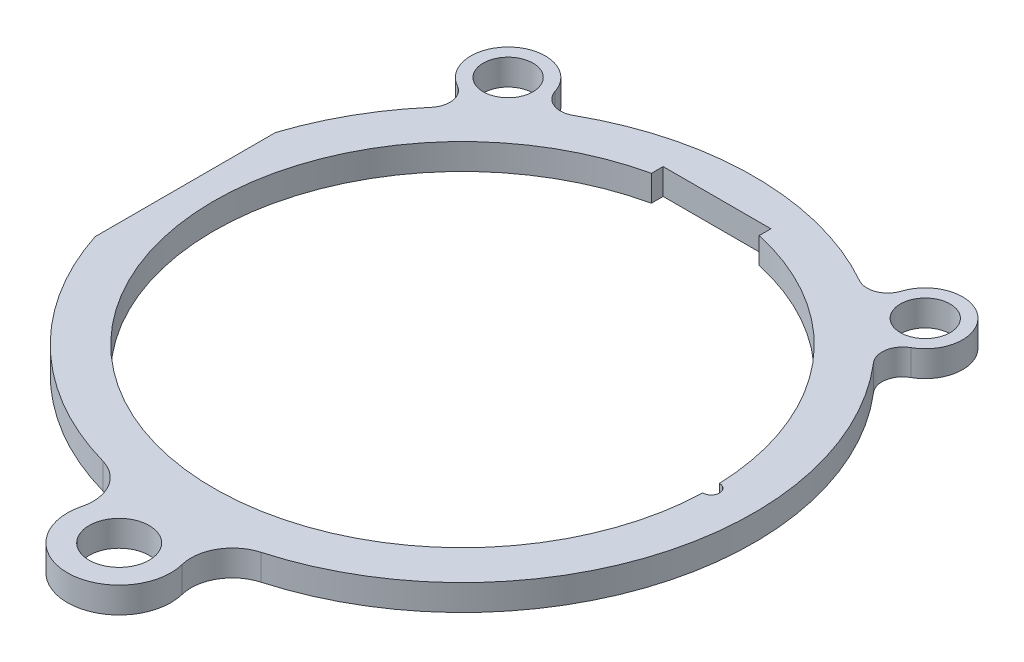
from build123d import *
from build123d.topology import SkipClean

# Parameters (mm, degrees)
SKETCH1_R           = 21.59
BOSS_EXTRUDE1_DEPTH = 0.79375
SKETCH2_R           = 1.4224
CUT_EXTRUDE1_DEPTH  = 31.574112518
CUT_EXTRUDE2_DEPTH  = 31.574112518
SKETCH4_R           = 0.508
CUT_EXTRUDE3_DEPTH  = 31.574112518
SKETCH5_R           = 1.0922
CUT_EXTRUDE4_DEPTH  = 31.574112518
SKETCH6_R           = 1.524
SKETCH6_R_2         = 1.8415
BOSS_EXTRUDE2_DEPTH = 1.5875


with BuildPart() as part:
    # Sketch1 → Boss-Extrude1 (new, symmetric)
    with BuildSketch(Plane(origin=(0, 0, 0), x_dir=(1, 0, 0), z_dir=(0, 1, 0))):
        with Locations(Location((0, 0, 0), (0, 0, 270))):
            Circle(SKETCH1_R)
        with BuildLine():
            Line((-3.302, 14.8779836), (-3.302, 15.5956))
            Line((-3.302, 15.5956), (3.302, 15.5956))
            Line((3.302, 15.5956), (3.302, 14.8779836))
            ThreePointArc((3.302, 14.8779836), (11.8865487, 9.537691545), (15.24, 0))
            ThreePointArc((15.24, 0), (-9.537691545, -11.8865487), (-3.302, 14.8779836))
        make_face(mode=Mode.SUBTRACT)
    extrude(amount=BOSS_EXTRUDE1_DEPTH, both=True)

    # Sketch2 → Cut-Extrude1 (cut, through all)
    with BuildSketch(Plane(origin=(0, 0.79375, 0), x_dir=(1, 0, 0), z_dir=(0, 1, 0))):
        with Locations(Location((0, 18.415, 0), (0, 0, 270))):
            Circle(SKETCH2_R)
        with Locations(Location((0, -18.415, 0), (0, 0, 270))):
            Circle(SKETCH2_R)
    extrude(amount=-CUT_EXTRUDE1_DEPTH, mode=Mode.SUBTRACT)

    # Sketch3 → Cut-Extrude2 (cut, through all)
    with BuildSketch(Plane(origin=(0, 0.79375, 0), x_dir=(1, 0, 0), z_dir=(0, 1, 0))):
        with BuildLine():
            Line((-20.871224203, 5.5245), (-16.984058744, 5.5245))
            Line((-16.984058744, 5.5245), (-16.984058744, -5.5245))
            Line((-16.984058744, -5.5245), (-20.871224203, -5.5245))
            ThreePointArc((-20.871224203, -5.5245), (-21.59, 0), (-20.871224203, 5.5245))
        make_face()
    extrude(amount=-CUT_EXTRUDE2_DEPTH, mode=Mode.SUBTRACT)

    # Sketch4 → Cut-Extrude3 (cut, through all)
    with BuildSketch(Plane(origin=(0, 0.79375, 0), x_dir=(1, 0, 0), z_dir=(0, 1, 0))):
        with Locations((15.24, 0)):
            Circle(SKETCH4_R)
    extrude(amount=-CUT_EXTRUDE3_DEPTH, mode=Mode.SUBTRACT)

    # Sketch5 → Cut-Extrude4 (cut, through all)
    # profile 1 of 16: a face of its own
    with BuildSketch(Plane(origin=(0, 0.79375, 0), x_dir=(1, 0, 0), z_dir=(0, 1, 0))):
        with BuildLine():
            ThreePointArc((-16.984058744, 5.5245), (-16.237733521, 7.437362555), (-15.276788696, 9.25192298))
            Line((-15.276788696, 9.25192298), (-17.314108781, 10.80523309))
            ThreePointArc((-17.314108781, 10.80523309), (-17.76113274, 11.28937197), (-18.016469323, 11.896845513))
            ThreePointArc((-18.016469323, 11.896845513), (-19.70316913, 8.826846902), (-20.871224203, 5.5245))
            Line((-20.871224203, 5.5245), (-16.984058744, 5.5245))
        make_face()
    # profile 2 of 16: a face of its own
    with BuildSketch(Plane(origin=(0, 0.79375, 0), x_dir=(1, 0, 0), z_dir=(0, 1, 0))):
        with BuildLine():
            Line((-17.314108781, 10.80523309), (-15.276788696, 9.25192298))
            ThreePointArc((-15.276788696, 9.25192298), (-14.202798716, 10.828613037), (-12.966760902, 12.28175327))
            Line((-12.966760902, 12.28175327), (-15.004080987, 13.83506338))
            ThreePointArc((-15.004080987, 13.83506338), (-15.589304916, 14.13793931), (-16.242705475, 14.223312513))
            ThreePointArc((-16.242705475, 14.223312513), (-17.169038314, 13.0901575), (-18.016469323, 11.896845513))
            ThreePointArc((-18.016469323, 11.896845513), (-17.76113274, 11.28937197), (-17.314108781, 10.80523309))
        make_face()
        with Locations((-16.159094884, 12.320148235)):
            Circle(SKETCH5_R, mode=Mode.SUBTRACT)
    # profile 3 of 16: a face of its own
    with BuildSketch(Plane(origin=(0, 0.79375, 0), x_dir=(1, 0, 0), z_dir=(0, 1, 0))):
        with Locations((-16.159094884, 12.320148235)):
            Circle(SKETCH5_R)
    # profile 4 of 16: a face of its own
    with BuildSketch(Plane(origin=(0, 0.79375, 0), x_dir=(1, 0, 0), z_dir=(0, 1, 0))):
        with BuildLine():
            Line((-15.004080987, 13.83506338), (-12.966760902, 12.28175327))
            ThreePointArc((-12.966760902, 12.28175327), (-7.645640437, 16.140710455), (-1.288911844, 17.813395463))
            ThreePointArc((-1.288911844, 17.813395463), (-0.308118121, 19.803627014), (1.4224, 18.415))
            ThreePointArc((1.4224, 18.415), (1.388627014, 18.106881879), (1.288911844, 17.813395463))
            ThreePointArc((1.288911844, 17.813395463), (5.420875683, 17.017416329), (9.25192298, 15.276788696))
            Line((9.25192298, 15.276788696), (10.80523309, 17.314108781))
            ThreePointArc((10.80523309, 17.314108781), (11.28937197, 17.76113274), (11.896845513, 18.016469323))
            ThreePointArc((11.896845513, 18.016469323), (-2.884204284, 21.396482553), (-16.242705475, 14.223312513))
            ThreePointArc((-16.242705475, 14.223312513), (-15.589304916, 14.13793931), (-15.004080987, 13.83506338))
        make_face()
    # profile 5 of 16: a face of its own
    with BuildSketch(Plane(origin=(0, 0.79375, 0), x_dir=(1, 0, 0), z_dir=(0, 1, 0))):
        with BuildLine():
            Line((10.80523309, 17.314108781), (9.25192298, 15.276788696))
            ThreePointArc((9.25192298, 15.276788696), (10.828613037, 14.202798716), (12.28175327, 12.966760902))
            Line((12.28175327, 12.966760902), (13.83506338, 15.004080987))
            ThreePointArc((13.83506338, 15.004080987), (14.13793931, 15.589304916), (14.223312513, 16.242705475))
            ThreePointArc((14.223312513, 16.242705475), (13.0901575, 17.169038314), (11.896845513, 18.016469323))
            ThreePointArc((11.896845513, 18.016469323), (11.28937197, 17.76113274), (10.80523309, 17.314108781))
        make_face()
        with Locations((12.320148235, 16.159094884)):
            Circle(SKETCH5_R, mode=Mode.SUBTRACT)
    # profile 6 of 16: a face of its own
    with BuildSketch(Plane(origin=(0, 0.79375, 0), x_dir=(1, 0, 0), z_dir=(0, 1, 0))):
        with Locations((12.320148235, 16.159094884)):
            Circle(SKETCH5_R)
    # profile 7 of 16: a face of its own
    with BuildSketch(Plane(origin=(0, 0.79375, 0), x_dir=(1, 0, 0), z_dir=(0, 1, 0))):
        with BuildLine():
            Line((13.83506338, 15.004080987), (12.28175327, 12.966760902))
            ThreePointArc((12.28175327, 12.966760902), (16.406249356, 7.057856172), (17.859965052, 0))
            ThreePointArc((17.859965052, 0), (17.202053132, -4.802886604), (15.276788696, -9.25192298))
            Line((15.276788696, -9.25192298), (17.314108781, -10.80523309))
            ThreePointArc((17.314108781, -10.80523309), (17.76113274, -11.28937197), (18.016469323, -11.896845513))
            ThreePointArc((18.016469323, -11.896845513), (21.396482553, 2.884204284), (14.223312513, 16.242705475))
            ThreePointArc((14.223312513, 16.242705475), (14.13793931, 15.589304916), (13.83506338, 15.004080987))
        make_face()
    # profile 8 of 16: a face of its own
    with BuildSketch(Plane(origin=(0, 0.79375, 0), x_dir=(1, 0, 0), z_dir=(0, 1, 0))):
        with BuildLine():
            ThreePointArc((4.602470139, -19.883377319), (4.576225926, -20.541808877), (4.327227494, -21.151907768))
            ThreePointArc((4.327227494, -21.151907768), (10.852736689, -18.664035104), (16.242705475, -14.223312513))
            ThreePointArc((16.242705475, -14.223312513), (15.589304916, -14.13793931), (15.004080987, -13.83506338))
            Line((15.004080987, -13.83506338), (12.966760902, -12.28175327))
            ThreePointArc((12.966760902, -12.28175327), (8.977744233, -15.439509712), (4.260223404, -17.344418359))
            Line((4.260223404, -17.344418359), (4.602470139, -19.883377319))
        make_face()
    # profile 9 of 16: a face of its own
    with BuildSketch(Plane(origin=(0, 0.79375, 0), x_dir=(1, 0, 0), z_dir=(0, 1, 0))):
        with BuildLine():
            ThreePointArc((15.004080987, -13.83506338), (15.589304916, -14.13793931), (16.242705475, -14.223312513))
            ThreePointArc((16.242705475, -14.223312513), (17.169038314, -13.0901575), (18.016469323, -11.896845513))
            ThreePointArc((18.016469323, -11.896845513), (17.76113274, -11.28937197), (17.314108781, -10.80523309))
            Line((17.314108781, -10.80523309), (15.276788696, -9.25192298))
            ThreePointArc((15.276788696, -9.25192298), (14.202798716, -10.828613037), (12.966760902, -12.28175327))
            Line((12.966760902, -12.28175327), (15.004080987, -13.83506338))
        make_face()
        with Locations((16.159094884, -12.320148235)):
            Circle(SKETCH5_R, mode=Mode.SUBTRACT)
    # profile 10 of 16: a face of its own
    with BuildSketch(Plane(origin=(0, 0.79375, 0), x_dir=(1, 0, 0), z_dir=(0, 1, 0))):
        with Locations((16.159094884, -12.320148235)):
            Circle(SKETCH5_R)
    # profile 11 of 16: a face of its own
    with BuildSketch(Plane(origin=(0, 0.79375, 0), x_dir=(1, 0, 0), z_dir=(0, 1, 0))):
        with BuildLine():
            ThreePointArc((0.826620277, -20.392354546), (1.026270462, -21.020335978), (1.427926458, -21.542727915))
            ThreePointArc((1.427926458, -21.542727915), (2.884204284, -21.396482553), (4.327227494, -21.151907768))
            ThreePointArc((4.327227494, -21.151907768), (4.576225926, -20.541808877), (4.602470139, -19.883377319))
            Line((4.602470139, -19.883377319), (4.260223404, -17.344418359))
            ThreePointArc((4.260223404, -17.344418359), (2.784458723, -17.64157423), (1.288911844, -17.813395463))
            ThreePointArc((1.288911844, -17.813395463), (1.388627014, -18.106881879), (1.4224, -18.415))
            ThreePointArc((1.4224, -18.415), (1.235821862, -19.119248596), (0.725034865, -19.638742704))
            Line((0.725034865, -19.638742704), (0.826620277, -20.392354546))
        make_face()
        with Locations((2.714545208, -20.137865932)):
            Circle(SKETCH5_R, mode=Mode.SUBTRACT)
    # profile 12 of 16: a face of its own
    with BuildSketch(Plane(origin=(0, 0.79375, 0), x_dir=(1, 0, 0), z_dir=(0, 1, 0))):
        with Locations((2.714545208, -20.137865932)):
            Circle(SKETCH5_R)
    # profile 13 of 16: a face of its own
    with BuildSketch(Plane(origin=(0, 0.79375, 0), x_dir=(1, 0, 0), z_dir=(0, 1, 0))):
        with BuildLine():
            ThreePointArc((-1.288911844, -17.813395463), (-5.420875683, -17.017416329), (-9.25192298, -15.276788696))
            Line((-9.25192298, -15.276788696), (-10.80523309, -17.314108781))
            ThreePointArc((-10.80523309, -17.314108781), (-11.28937197, -17.76113274), (-11.896845513, -18.016469323))
            ThreePointArc((-11.896845513, -18.016469323), (-5.523422079, -20.871509494), (1.427926458, -21.542727915))
            ThreePointArc((1.427926458, -21.542727915), (1.026270462, -21.020335978), (0.826620277, -20.392354546))
            Line((0.826620277, -20.392354546), (0.725034865, -19.638742704))
            ThreePointArc((0.725034865, -19.638742704), (-0.955229003, -19.468925667), (-1.288911844, -17.813395463))
        make_face()
    # profile 14 of 16: a face of its own
    with BuildSketch(Plane(origin=(0, 0.79375, 0), x_dir=(1, 0, 0), z_dir=(0, 1, 0))):
        with BuildLine():
            ThreePointArc((-14.223312513, -16.242705475), (-14.13793931, -15.589304916), (-13.83506338, -15.004080987))
            Line((-13.83506338, -15.004080987), (-12.28175327, -12.966760902))
            ThreePointArc((-12.28175327, -12.966760902), (-15.098634046, -9.539895263), (-16.984058744, -5.5245))
            Line((-16.984058744, -5.5245), (-20.871224203, -5.5245))
            ThreePointArc((-20.871224203, -5.5245), (-18.34738698, -11.379872188), (-14.223312513, -16.242705475))
        make_face()
    # profile 15 of 16: a face of its own
    with BuildSketch(Plane(origin=(0, 0.79375, 0), x_dir=(1, 0, 0), z_dir=(0, 1, 0))):
        with BuildLine():
            Line((-12.28175327, -12.966760902), (-13.83506338, -15.004080987))
            ThreePointArc((-13.83506338, -15.004080987), (-14.13793931, -15.589304916), (-14.223312513, -16.242705475))
            ThreePointArc((-14.223312513, -16.242705475), (-13.0901575, -17.169038314), (-11.896845513, -18.016469323))
            ThreePointArc((-11.896845513, -18.016469323), (-11.28937197, -17.76113274), (-10.80523309, -17.314108781))
            Line((-10.80523309, -17.314108781), (-9.25192298, -15.276788696))
            ThreePointArc((-9.25192298, -15.276788696), (-10.828613037, -14.202798716), (-12.28175327, -12.966760902))
        make_face()
        with Locations((-12.320148235, -16.159094884)):
            Circle(SKETCH5_R, mode=Mode.SUBTRACT)
    # profile 16 of 16: a face of its own
    with BuildSketch(Plane(origin=(0, 0.79375, 0), x_dir=(1, 0, 0), z_dir=(0, 1, 0))):
        with Locations((-12.320148235, -16.159094884)):
            Circle(SKETCH5_R)
    extrude(amount=-CUT_EXTRUDE4_DEPTH, mode=Mode.SUBTRACT)

    # Sketch6 → Boss-Extrude2 (add)
    # profile 1 of 4: a face of its own
    with SkipClean():  # the faces are left unmerged after this step: merging them gives an invalid solid
        with BuildSketch(Plane(origin=(0, 0.79375, 0), x_dir=(1, 0, 0), z_dir=(0, 1, 0))):
            with BuildLine():
                ThreePointArc((-1.288911844, 17.813395463), (0, 16.9926), (1.288911844, 17.813395463))
                ThreePointArc((1.288911844, 17.813395463), (0, 17.859965052), (-1.288911844, 17.813395463))
            make_face()
        # profile 2 of 4: a face of its own
        with BuildSketch(Plane(origin=(0, 0.79375, 0), x_dir=(1, 0, 0), z_dir=(0, 1, 0))):
            with BuildLine():
                ThreePointArc((10.603438462, 16.274857531), (9.857305852, 15.481530327), (8.7709155, 15.557936655))
                ThreePointArc((8.7709155, 15.557936655), (11.329244242, 13.806758366), (13.546192537, 11.639545499))
                ThreePointArc((13.546192537, 11.639545499), (13.259158239, 12.690113464), (13.891550345, 13.57677121))
                ThreePointArc((13.891550345, 13.57677121), (14.229435023, 17.341171675), (10.603438462, 16.274857531))
            make_face()
            with Locations(Location((12.779339593, 15.573965052, 0), (0, 0, 270))):
                Circle(SKETCH6_R, mode=Mode.SUBTRACT)
        # profile 3 of 4: a face of its own
        with BuildSketch(Plane(origin=(0, 0.79375, 0), x_dir=(1, 0, 0), z_dir=(0, 1, 0))):
            with BuildLine():
                ThreePointArc((-8.770915597, 15.5579366), (-9.857305886, 15.48153034), (-10.60343845, 16.274857493))
                ThreePointArc((-10.60343845, 16.274857493), (-14.229434867, 17.341171803), (-13.891550662, 13.576771387))
                ThreePointArc((-13.891550662, 13.576771387), (-13.259158273, 12.690113657), (-13.546192517, 11.639545523))
                ThreePointArc((-13.546192517, 11.639545523), (-11.329244273, 13.806758341), (-8.770915597, 15.5579366))
            make_face()
            with Locations(Location((-12.779339593, 15.573965052, 0), (0, 0, 270))):
                Circle(SKETCH6_R, mode=Mode.SUBTRACT)
        # profile 4 of 4: a face of its own
        with BuildSketch(Plane(origin=(0, 0.79375, 0), x_dir=(1, 0, 0), z_dir=(0, 1, 0))):
            with BuildLine():
                ThreePointArc((3.078011458, -20.256202915), (3.341190791, -18.362372667), (4.850583348, -17.188664662))
                ThreePointArc((4.850583348, -17.188664662), (3.085599204, -17.591402139), (1.288911844, -17.813395463))
                ThreePointArc((1.288911844, -17.813395463), (0, -16.9926), (-1.288911844, -17.813395463))
                ThreePointArc((-1.288911844, -17.813395463), (-3.08559897, -17.59140218), (-4.85058289, -17.188664791))
                ThreePointArc((-4.85058289, -17.188664791), (-3.34119067, -18.362372877), (-3.07801146, -20.256202925))
                ThreePointArc((-3.07801146, -20.256202925), (5e-09, -24.209965052), (3.078011458, -20.256202915))
            make_face()
            with Locations(Location((0, -21.034965052, 0), (0, 0, 270))):
                Circle(SKETCH6_R_2, mode=Mode.SUBTRACT)
        extrude(amount=-BOSS_EXTRUDE2_DEPTH)


solid = part.part
